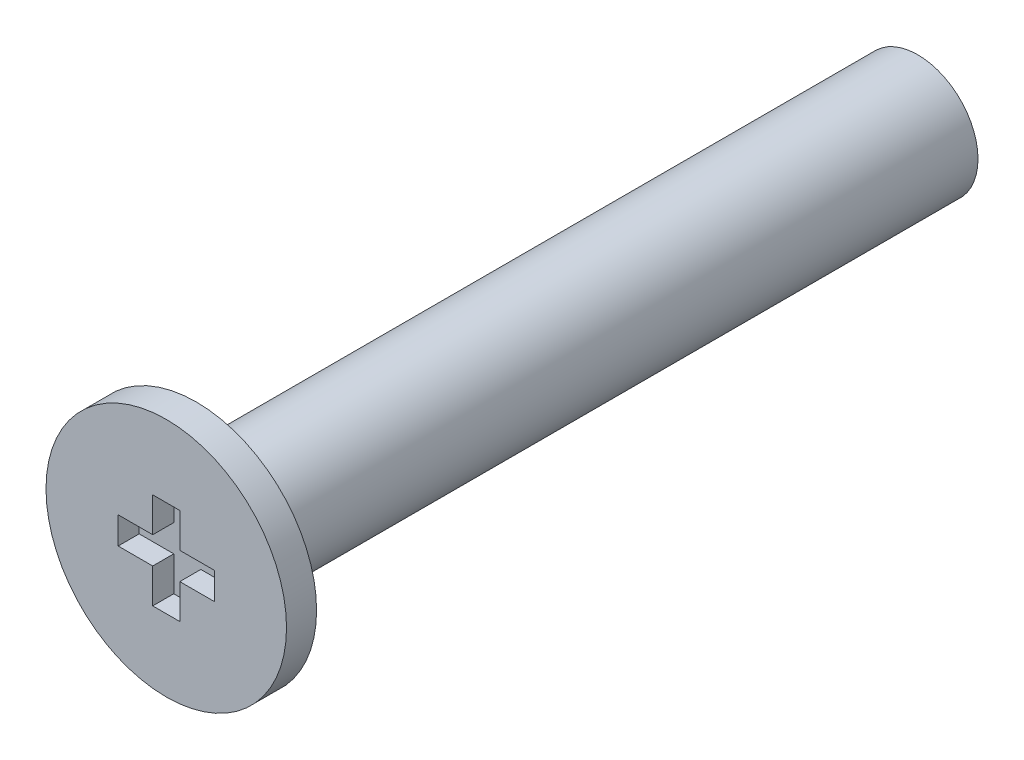
from build123d import *

# Parameters (mm, degrees)
SKETCH_1_R        = 1
EXTRUDE_198_DEPTH = 12
SKETCH_8_W        = 2
SKETCH_8_H        = 0.5
PH0_START         = 0.51
PH0_DEPTH         = 0.36


with BuildPart() as part:
    # 草图1 → Extrude 198 (new body)
    with BuildSketch(Plane.XY):
        Circle(SKETCH_1_R)
    extrude(amount=-EXTRUDE_198_DEPTH)

    # 草图8 → Revolve 375 (revolve)
    with BuildSketch(Plane(origin=(0, 0, 0), x_dir=(1, 0, 0), z_dir=(0, 1, 0)), mode=Mode.PRIVATE) as revolve_375_sk:
        with Locations((1, -0.25)):
            Rectangle(SKETCH_8_W, SKETCH_8_H)
    revolve(revolve_375_sk.sketch.rotate(Axis((0, 0, -2), (0, 0, 1)), 180), axis=Axis((0, 0, -2), (0, 0, 1)))

    # 草图9 → 十字槽_PH0_简化 (cut)
    with BuildSketch(Plane.XY.offset(PH0_START)):
        Polygon((-0.225, -0.8), (0.225, -0.8), (0.225, -0.225), (0.8, -0.225), (0.8, 0.225), (0.225, 0.225), (0.225, 0.8), (-0.225, 0.8), (-0.225, 0.225), (-0.8, 0.225), (-0.8, -0.225), (-0.225, -0.225), align=None)
    extrude(amount=-PH0_DEPTH, mode=Mode.SUBTRACT)


solid = part.part
